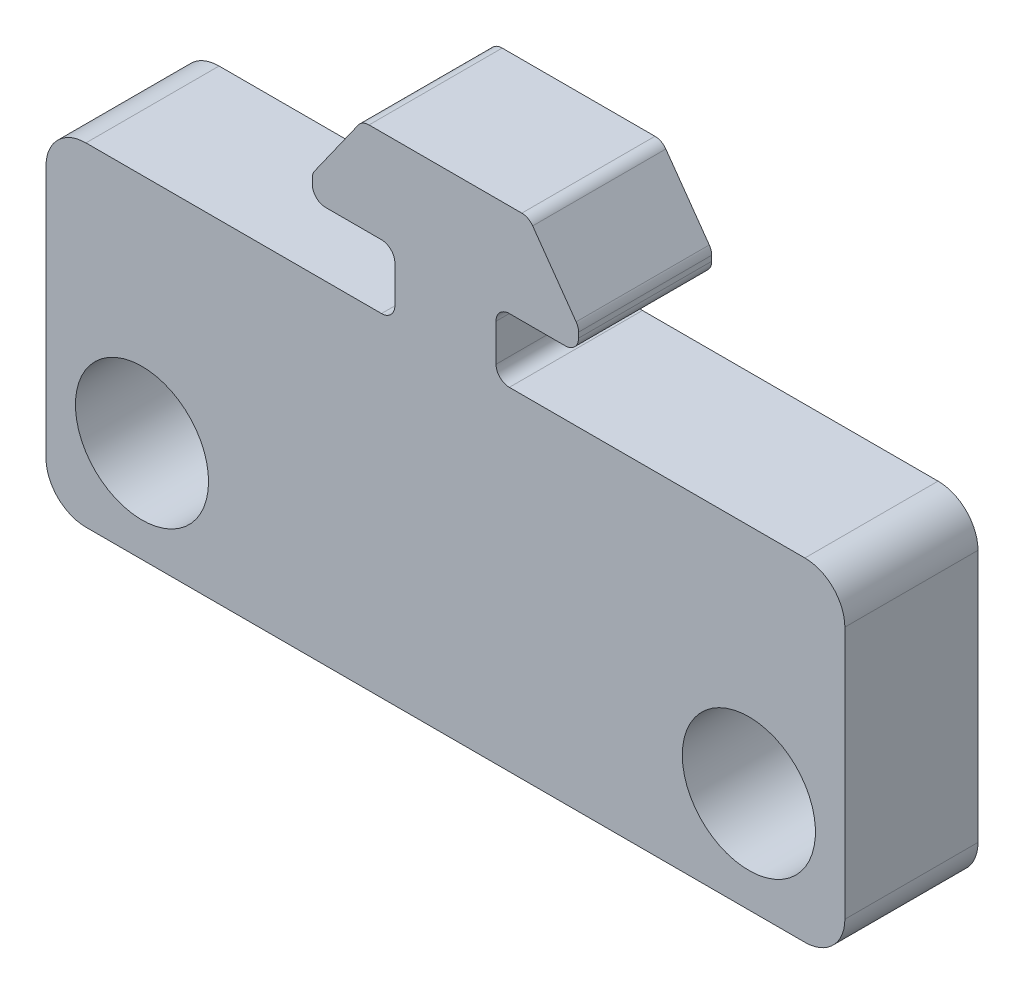
from build123d import *

# Parameters (mm, degrees)
BOSS_EXTRUDE1_DEPTH = 10
BOSS_EXTRUDE2_DEPTH = 10
SKETCH5_R           = 5
CUT_EXTRUDE1_DEPTH  = 44.45158225
FILLET1_R           = 1
FILLET2_R           = 1
FILLET3_R           = 3


with BuildPart() as part:
    # Sketch2 → Boss-Extrude1 (new body)
    with BuildSketch(Plane.XY):
        Polygon((-10, 0), (0, 0), (0, 7), (-6.25480432, 7), (-10, 1.709943763), align=None)
        Polygon((0, 0), (10, 0), (10, 1.709943763), (6.25480432, 7), (0, 7), align=None)
    extrude(amount=BOSS_EXTRUDE1_DEPTH)

    # Sketch4 → Boss-Extrude2 (add)
    with BuildSketch(Plane.XY):
        Polygon((0, 0), (-3.8, 0), (-3.8, -4.8), (-30, -4.8), (-30, -22.686959784), (-30, -23.48), (-30, -29.8), (0, -29.8), align=None)
        Polygon((3.8, 0), (0, 0), (0, -29.8), (30, -29.8), (30, -23.48), (30, -22.686959784), (30, -4.8), (3.8, -4.8), align=None)
    extrude(amount=BOSS_EXTRUDE2_DEPTH)

    # Sketch5 → Cut-Extrude1 (cut, through all)
    with BuildSketch(Plane.XY):
        with Locations((-22.790976064, -22.227391232)):
            Circle(SKETCH5_R)
        with Locations(Location((22.790976064, -22.227391232, 0), (0, 0, 180))):
            Circle(SKETCH5_R)
    extrude(amount=CUT_EXTRUDE1_DEPTH, mode=Mode.SUBTRACT)

    # Fillet1
    fillet1_edges = [part.edges().sort_by_distance(p)[0] for p in [
        (-10, 0, 5),
        (-10, 1.709943763, 5),
        (-6.25480432, 7, 5),
        (6.25480432, 7, 5),
        (10, 1.709943763, 5),
        (10, 0, 5),
    ]]
    fillet(fillet1_edges, radius=FILLET1_R)

    # Fillet2
    fillet2_edges = [part.edges().sort_by_distance(p)[0] for p in [
        (3.8, -4.8, 5),
        (3.8, 0, 5),
        (-3.8, 0, 5),
        (-3.8, -4.8, 5),
    ]]
    fillet(fillet2_edges, radius=FILLET2_R)

    # Fillet3
    fillet3_edges = [part.edges().sort_by_distance(p)[0] for p in [
        (-30, -29.8, 5),
        (30, -29.8, 5),
        (30, -4.8, 5),
        (-30, -4.8, 5),
    ]]
    fillet(fillet3_edges, radius=FILLET3_R)


solid = part.part
